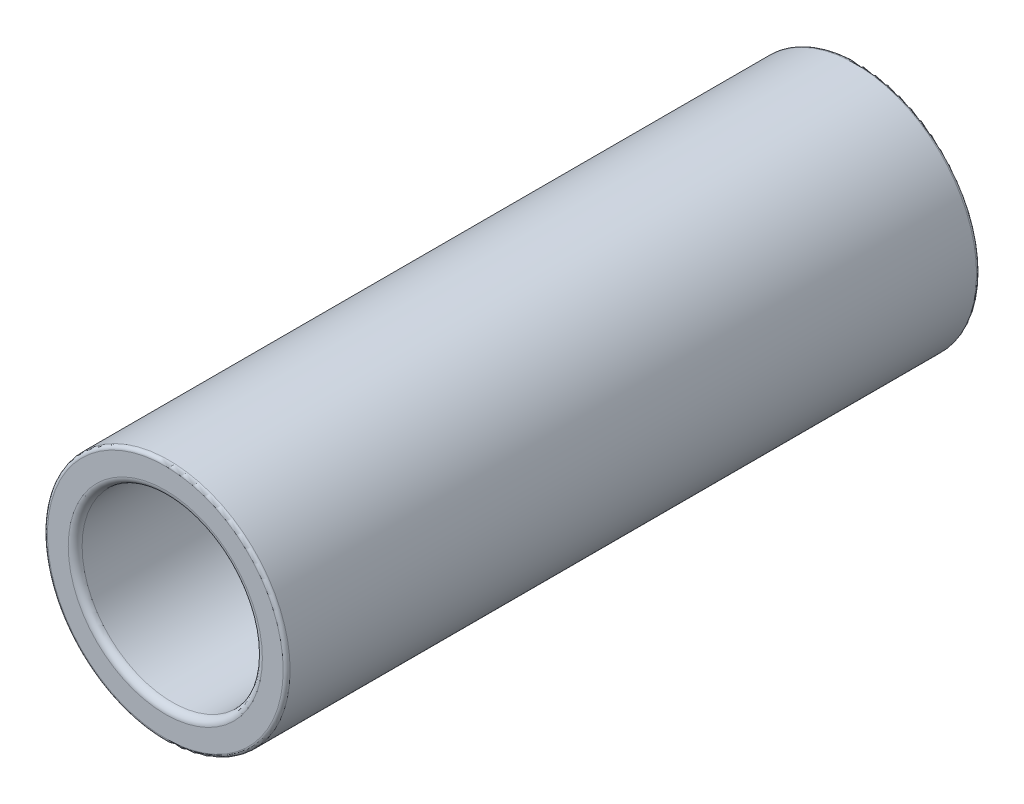
from build123d import *

# Parameters (mm, degrees)
CROQUIS1_R              = 3.5
CROQUIS1_R_2            = 2.6
SALIENTE_EXTRUIR2_DEPTH = 20
REDONDEO5_R             = 0.1
REDONDEO6_R             = 0.2


with BuildPart() as part:
    # Croquis1 → Saliente-Extruir2 (new body)
    with BuildSketch(Plane.XY):
        Circle(CROQUIS1_R)
        Circle(CROQUIS1_R_2, mode=Mode.SUBTRACT)
    extrude(amount=SALIENTE_EXTRUIR2_DEPTH)

    # Redondeo5
    redondeo5_edges = [part.edges().sort_by_distance(p)[0] for p in [
        (-3.5, 0, 0),
        (-3.5, 0, 20),
    ]]
    fillet(redondeo5_edges, radius=REDONDEO5_R)

    # Redondeo6
    redondeo6_edges = [part.edges().sort_by_distance(p)[0] for p in [
        (-2.6, 0, 0),
        (-2.6, 0, 20),
    ]]
    fillet(redondeo6_edges, radius=REDONDEO6_R)


solid = part.part
